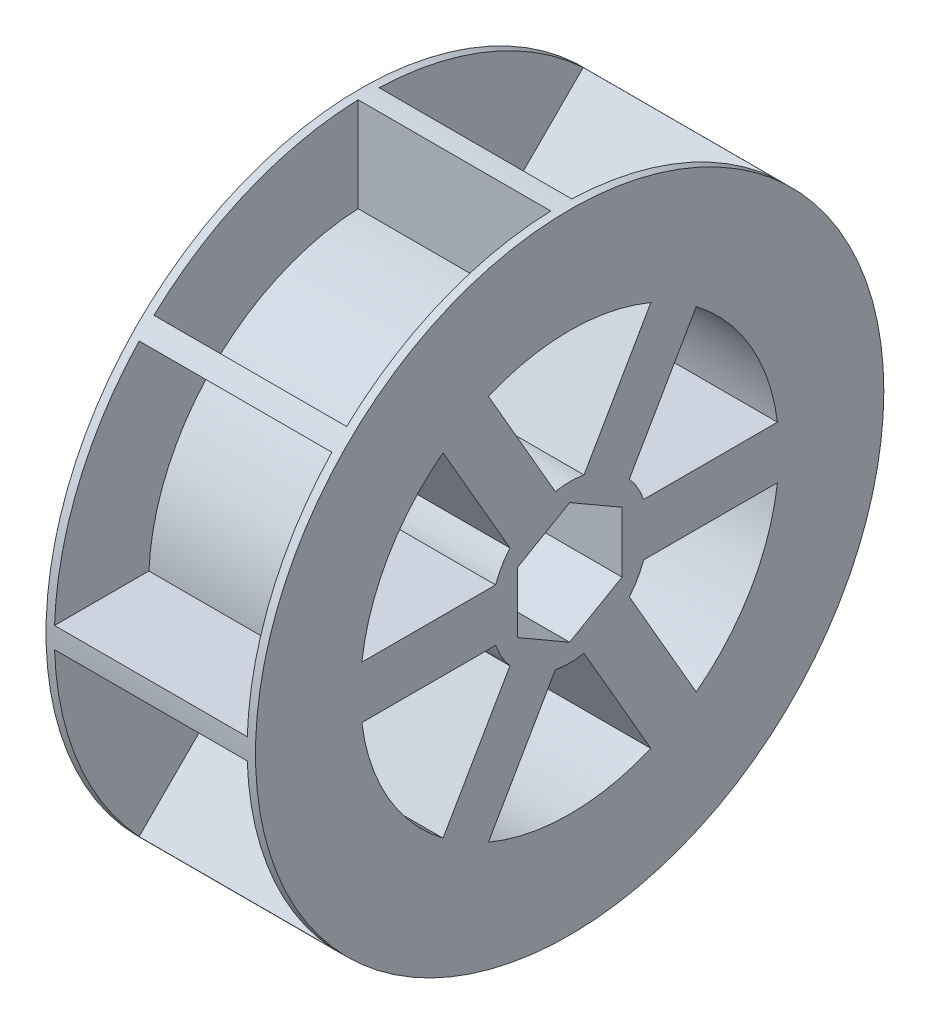
from build123d import *

# Parameters (mm, degrees)
BOSS_EXTRUDE1_DEPTH = 50
SKETCH4_R           = 150
SKETCH4_R_2         = 100
BOSS_EXTRUDE3_DEPTH = 100
CUT_EXTRUDE1_DEPTH  = 120
SKETCH7_R           = 150
SKETCH7_R_2         = 105
BOSS_EXTRUDE6_DEPTH = 4


with BuildPart() as part:
    # Sketch2 → Boss-Extrude1 (new, symmetric)
    with BuildSketch(Plane.YZ):
        with BuildLine():
            Line((-24.368621785, -28.502987077), (-80.352540378, -60.825317547))
            Line((-80.352540378, -60.825317547), (-92.852540378, -39.174682453))
            Line((-92.852540378, -39.174682453), (-36.868621785, -6.852351982))
            ThreePointArc((-36.868621785, -6.852351982), (-37.5, 0), (-36.868621785, 6.852351982))
            Line((-36.868621785, 6.852351982), (-92.852540378, 39.174682453))
            Line((-92.852540378, 39.174682453), (-80.352540378, 60.825317547))
            Line((-80.352540378, 60.825317547), (-24.368621785, 28.502987077))
            ThreePointArc((-24.368621785, 28.502987077), (-18.75, 32.475952642), (-12.5, 35.355339059))
            Line((-12.5, 35.355339059), (-12.5, 100))
            Line((-12.5, 100), (12.5, 100))
            Line((12.5, 100), (12.5, 35.355339059))
            ThreePointArc((12.5, 35.355339059), (18.75, 32.475952642), (24.368621785, 28.502987077))
            Line((24.368621785, 28.502987077), (80.352540378, 60.825317547))
            Line((80.352540378, 60.825317547), (92.852540378, 39.174682453))
            Line((92.852540378, 39.174682453), (36.868621785, 6.852351982))
            ThreePointArc((36.868621785, 6.852351982), (37.5, 0), (36.868621785, -6.852351982))
            Line((36.868621785, -6.852351982), (92.852540378, -39.174682453))
            Line((92.852540378, -39.174682453), (80.352540378, -60.825317547))
            Line((80.352540378, -60.825317547), (24.368621785, -28.502987077))
            ThreePointArc((24.368621785, -28.502987077), (18.75, -32.475952642), (12.5, -35.355339059))
            Line((12.5, -35.355339059), (12.5, -100))
            Line((12.5, -100), (-12.5, -100))
            Line((-12.5, -100), (-12.5, -35.355339059))
            ThreePointArc((-12.5, -35.355339059), (-18.75, -32.475952642), (-24.368621785, -28.502987077))
        make_face()
        Polygon((-14.43375673, -25), (14.43375673, -25), (28.867513459, 0), (14.43375673, 25), (-14.43375673, 25), (-28.867513459, 0), align=None, mode=Mode.SUBTRACT)
    extrude(amount=BOSS_EXTRUDE1_DEPTH, both=True)

    # Sketch4 → Boss-Extrude3 (add)
    with BuildSketch(Plane.YZ.offset(50)):
        with Locations(Location((0, 0, 0), (0, 0, 270))):
            Circle(SKETCH4_R)
        Circle(SKETCH4_R_2, mode=Mode.SUBTRACT)
    extrude(amount=-BOSS_EXTRUDE3_DEPTH)

    # Sketch5 → Cut-Extrude1 (cut)
    with BuildSketch(Plane.YZ.offset(50)):
        with BuildLine():
            ThreePointArc((-70.626450965, 77.697518777), (-40.181760398, 97.007350914), (-5, 104.880884817))
            Line((-5, 104.880884817), (-5, 149.916643506))
            ThreePointArc((-5, 149.916643506), (-57.402514855, 138.581929877), (-102.47154133, 109.542609142))
            Line((-102.47154133, 109.542609142), (-70.626450965, 77.697518777))
        make_face()
        with BuildLine():
            Line((70.626450965, 77.697518777), (102.47154133, 109.542609142))
            ThreePointArc((102.47154133, 109.542609142), (57.402514855, 138.581929877), (5, 149.916643506))
            Line((5, 149.916643506), (5, 104.880884817))
            ThreePointArc((5, 104.880884817), (40.181760398, 97.007350914), (70.626450965, 77.697518777))
        make_face()
        with BuildLine():
            ThreePointArc((149.916643506, 5), (138.581929877, 57.402514855), (109.542609142, 102.47154133))
            Line((109.542609142, 102.47154133), (77.697518777, 70.626450965))
            ThreePointArc((77.697518777, 70.626450965), (97.007350914, 40.181760398), (104.880884817, 5))
            Line((104.880884817, 5), (149.916643506, 5))
        make_face()
        with BuildLine():
            Line((149.916643506, -5), (104.880884817, -5))
            ThreePointArc((104.880884817, -5), (97.007350914, -40.181760398), (77.697518777, -70.626450965))
            Line((77.697518777, -70.626450965), (109.542609142, -102.47154133))
            ThreePointArc((109.542609142, -102.47154133), (138.581929877, -57.402514855), (149.916643506, -5))
        make_face()
        with BuildLine():
            Line((102.47154133, -109.542609142), (70.626450965, -77.697518777))
            ThreePointArc((70.626450965, -77.697518777), (40.181760398, -97.007350914), (5, -104.880884817))
            Line((5, -104.880884817), (5, -149.916643506))
            ThreePointArc((5, -149.916643506), (57.402514855, -138.581929877), (102.47154133, -109.542609142))
        make_face()
        with BuildLine():
            Line((-5, -149.916643506), (-5, -104.880884817))
            ThreePointArc((-5, -104.880884817), (-40.181760398, -97.007350914), (-70.626450965, -77.697518777))
            Line((-70.626450965, -77.697518777), (-102.47154133, -109.542609142))
            ThreePointArc((-102.47154133, -109.542609142), (-57.402514855, -138.581929877), (-5, -149.916643506))
        make_face()
        with BuildLine():
            ThreePointArc((-77.697518777, -70.626450965), (-97.007350914, -40.181760398), (-104.880884817, -5))
            Line((-104.880884817, -5), (-149.916643506, -5))
            ThreePointArc((-149.916643506, -5), (-138.581929877, -57.402514855), (-109.542609142, -102.47154133))
            Line((-109.542609142, -102.47154133), (-77.697518777, -70.626450965))
        make_face()
        with BuildLine():
            ThreePointArc((-104.880884817, 5), (-97.007350914, 40.181760398), (-77.697518777, 70.626450965))
            Line((-77.697518777, 70.626450965), (-109.542609142, 102.47154133))
            ThreePointArc((-109.542609142, 102.47154133), (-138.581929877, 57.402514855), (-149.916643506, 5))
            Line((-149.916643506, 5), (-104.880884817, 5))
        make_face()
    extrude(amount=-CUT_EXTRUDE1_DEPTH, mode=Mode.SUBTRACT)

    # Sketch7 → Boss-Extrude6 (add)
    with BuildSketch(Plane.YZ.offset(50)):
        with Locations(Location((0, 0, 0), (0, 0, 270))):
            Circle(SKETCH7_R)
        Circle(SKETCH7_R_2, mode=Mode.SUBTRACT)
    boss_extrude6 = extrude(amount=-BOSS_EXTRUDE6_DEPTH)

    # Mirror2: Boss-Extrude6 across plane
    add(boss_extrude6.mirror(Plane(origin=(0, 0, 0), x_dir=(0, 0, 1), z_dir=(1, 0, 0))))


solid = part.part
